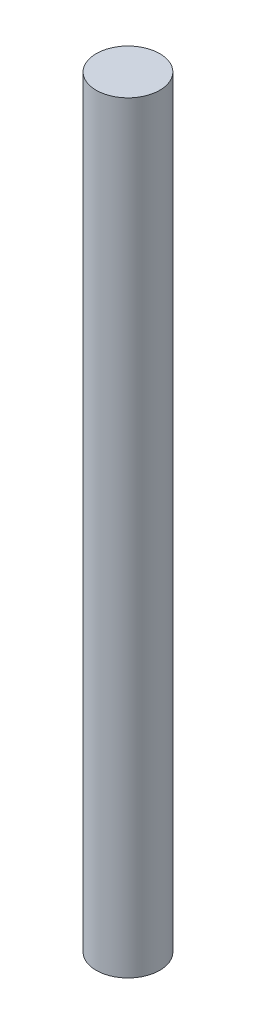
from build123d import *

# Parameters (mm, degrees)
SKETCH1_R           = 1
BOSS_EXTRUDE1_DEPTH = 24


with BuildPart() as part:
    # Sketch1 → Boss-Extrude1 (new body)
    with BuildSketch(Plane(origin=(0, 0, 0), x_dir=(1, 0, 0), z_dir=(0, 1, 0))):
        with Locations(Location((0, 0, 0), (0, 0, 270))):
            Circle(SKETCH1_R)
    extrude(amount=BOSS_EXTRUDE1_DEPTH)


solid = part.part
